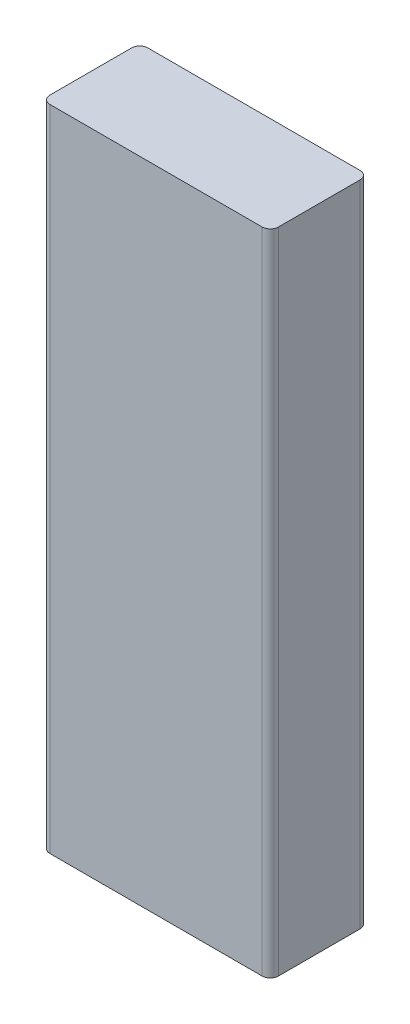
from build123d import *

# Parameters (mm, degrees)
SKETCH1_W           = 88.9
SKETCH1_H           = 38.1
BOSS_EXTRUDE1_DEPTH = 252.4125
FILLET1_R           = 3.175


with BuildPart() as part:
    # Sketch1 → Boss-Extrude1 (new body)
    with BuildSketch(Plane(origin=(0, 0, 0), x_dir=(1, 0, 0), z_dir=(0, 1, 0))):
        Rectangle(SKETCH1_W, SKETCH1_H)
    extrude(amount=BOSS_EXTRUDE1_DEPTH)

    # Fillet1
    fillet1_edges = [part.edges().sort_by_distance(p)[0] for p in [
        (44.45, 126.20625, 19.05),
        (-44.45, 126.20625, 19.05),
        (-44.45, 126.20625, -19.05),
        (44.45, 126.20625, -19.05),
    ]]
    fillet(fillet1_edges, radius=FILLET1_R)


solid = part.part
